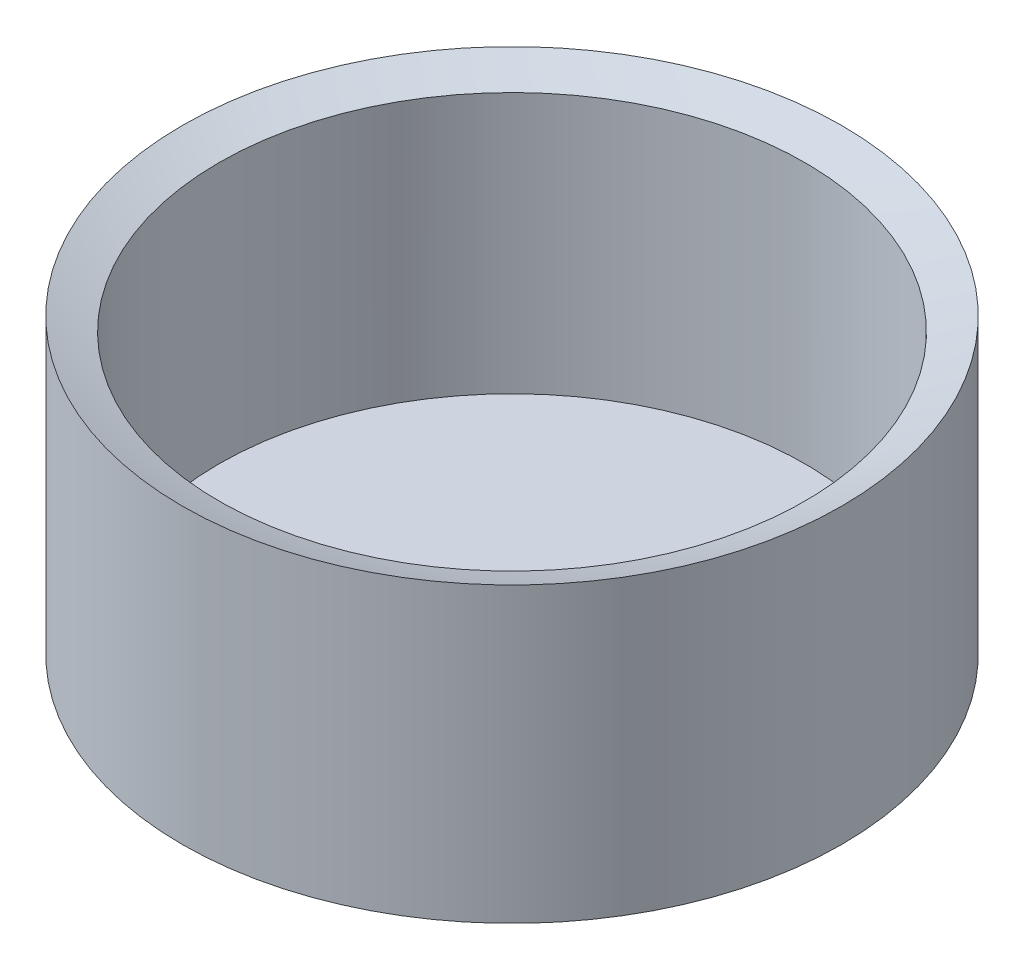
from build123d import *

# Parameters (mm, degrees)
SKETCH1_W           = 6.35
SKETCH1_H           = 50.8
BOSS_EXTRUDE1_START = 3.175
SKETCH2_R           = 57.15
BOSS_EXTRUDE1_DEPTH = 3.175


with BuildPart() as part:
    # Sketch1 → Revolve1 (revolve)
    with BuildSketch(Plane.XY, mode=Mode.PRIVATE) as revolve1_sk:
        with Locations((3.175, 25.4)):
            Rectangle(SKETCH1_W, SKETCH1_H)
    revolve(revolve1_sk.sketch.rotate(Axis((-50.8, 50.8, 0), (0, -1, 0)), 180), axis=Axis((-50.8, 50.8, 0), (0, -1, 0)))

    # Sketch2 → Boss-Extrude1 (add)
    with BuildSketch(Plane(origin=(0, 0, 0), x_dir=(1, 0, 0), z_dir=(0, 1, 0)).offset(BOSS_EXTRUDE1_START)):
        with Locations(Location((-50.8, 0, 0), (0, 0, 180))):
            Circle(SKETCH2_R)
    extrude(amount=-BOSS_EXTRUDE1_DEPTH)

    # Sketch4 → Cut-Revolve1 (revolve, cut)
    with BuildSketch(Plane.XY):
        with BuildLine():
            Line((-107.95, 50.8), (-50.8, 50.8))
            Line((-50.8, 50.8), (-50.8, 39.678581179))
            ThreePointArc((-50.8, 39.678581179), (-79.911030798, 42.484771528), (-107.95, 50.8))
        make_face()
    revolve(axis=Axis((-50.8, 46.230510517, 0), (0, 1, 0)), mode=Mode.SUBTRACT)


solid = part.part
